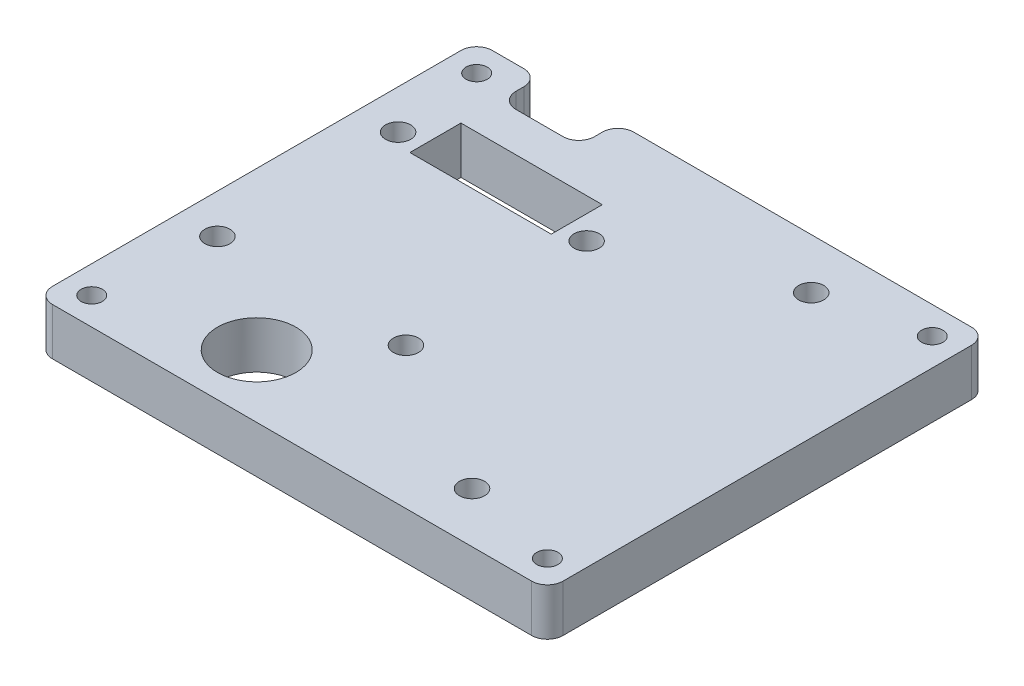
from build123d import *

# Parameters (mm, degrees)
SKETCH_1_W          = 65
SKETCH_1_H          = 56
EXTRUDE_1_DEPTH     = 6
SKETCH_2_R          = 1.35
CUT_EXTRUDE_1_DEPTH = 6
FILLET_2_R          = 2
SKETCH_5_R          = 1.6
CUT_EXTRUDE_3_DEPTH = 6
SKETCH_7_R          = 1.6
CUT_EXTRUDE_4_DEPTH = 6
SKETCH_8_R          = 5
CUT_EXTRUDE_5_DEPTH = 6
SKETCH_9_W          = 18
SKETCH_9_H          = 6.5
CUT_EXTRUDE_6_DEPTH = 6
SKETCH_10_W         = 10
SKETCH_10_H         = 5
CUT_EXTRUDE_7_DEPTH = 6
FILLET_3_R          = 2


with BuildPart() as part:
    # 草图1 → 凸台-拉伸1 (new body)
    with BuildSketch(Plane(origin=(0, 0, 0), x_dir=(1, 0, 0), z_dir=(0, 1, 0))):
        Rectangle(SKETCH_1_W, SKETCH_1_H)
    extrude(amount=EXTRUDE_1_DEPTH)

    # 草图2 → 切除-拉伸1 (cut)
    with BuildSketch(Plane(origin=(0, 6, 0), x_dir=(1, 0, 0), z_dir=(0, 1, 0))):
        with Locations(Location((-29, 24.5, 0), (0, 0, 270))):
            Circle(SKETCH_2_R)
        with Locations(Location((29, 24.5, 0), (0, 0, 90))):
            Circle(SKETCH_2_R)
        with Locations(Location((29, -24.5, 0), (0, 0, 270))):
            Circle(SKETCH_2_R)
        with Locations(Location((-29, -24.5, 0), (0, 0, 90))):
            Circle(SKETCH_2_R)
    extrude(amount=-CUT_EXTRUDE_1_DEPTH, mode=Mode.SUBTRACT)

    # 圆角2
    fillet_2_edges = [part.edges().sort_by_distance(p)[0] for p in [
        (32.5, 3, 28),
        (-32.5, 3, 28),
        (-32.5, 3, -28),
        (32.5, 3, -28),
    ]]
    fillet(fillet_2_edges, radius=FILLET_2_R)

    # 草图5 → 切除-拉伸3 (cut)
    with BuildSketch(Plane(origin=(0, 6, 0), x_dir=(1, 0, 0), z_dir=(0, 1, 0))):
        with Locations(Location((-27.5, 13, 0), (0, 0, 270))):
            Circle(SKETCH_5_R)
        with Locations(Location((-3.5, 13, 0), (0, 0, 90))):
            Circle(SKETCH_5_R)
        with Locations(Location((-27.5, -10, 0), (0, 0, 270))):
            Circle(SKETCH_5_R)
        with Locations(Location((-3.5, -10, 0), (0, 0, 90))):
            Circle(SKETCH_5_R)
    extrude(amount=-CUT_EXTRUDE_3_DEPTH, mode=Mode.SUBTRACT)

    # 草图7 → 切除-拉伸4 (cut)
    with BuildSketch(Plane(origin=(0, 6, 0), x_dir=(1, 0, 0), z_dir=(0, 1, 0))):
        with Locations(Location((16.5, 21.59, 0), (0, 0, 270))):
            Circle(SKETCH_7_R)
        with Locations(Location((16.5, -21.59, 0), (0, 0, 90))):
            Circle(SKETCH_7_R)
    extrude(amount=-CUT_EXTRUDE_4_DEPTH, mode=Mode.SUBTRACT)

    # 草图8 → 切除-拉伸5 (cut)
    with BuildSketch(Plane(origin=(0, 6, 0), x_dir=(1, 0, 0), z_dir=(0, 1, 0))):
        with Locations(Location((-12.5, -20, 0), (0, 0, 270))):
            Circle(SKETCH_8_R)
    extrude(amount=-CUT_EXTRUDE_5_DEPTH, mode=Mode.SUBTRACT)

    # 草图9 → 切除-拉伸6 (cut)
    with BuildSketch(Plane(origin=(0, 6, 0), x_dir=(1, 0, 0), z_dir=(0, 1, 0))):
        with Locations((-15.5, 14.75)):
            Rectangle(SKETCH_9_W, SKETCH_9_H)
    extrude(amount=-CUT_EXTRUDE_6_DEPTH, mode=Mode.SUBTRACT)

    # 草图10 → 切除-拉伸7 (cut)
    with BuildSketch(Plane(origin=(0, 6, 0), x_dir=(1, 0, 0), z_dir=(0, 1, 0))):
        with Locations((-19.5, 25.5)):
            Rectangle(SKETCH_10_W, SKETCH_10_H)
    extrude(amount=-CUT_EXTRUDE_7_DEPTH, mode=Mode.SUBTRACT)

    # 圆角3
    fillet_3_edges = [part.edges().sort_by_distance(p)[0] for p in [
        (-14.5, 3, -23),
        (-14.5, 3, -28),
        (-24.5, 3, -28),
        (-24.5, 3, -23),
    ]]
    fillet(fillet_3_edges, radius=FILLET_3_R)


solid = part.part
